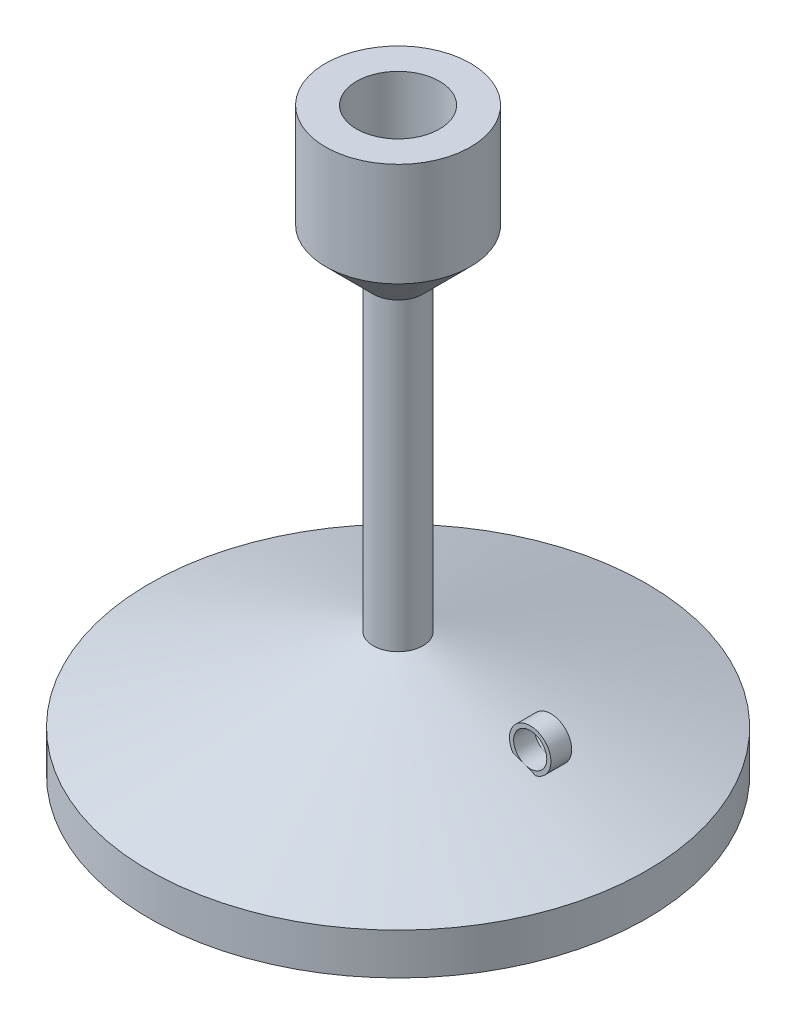
from build123d import *

# Parameters (mm, degrees)
SKETCH3_R           = 5
SKETCH3_R_2         = 4
BOSS_EXTRUDE1_DEPTH = 2.5


with BuildPart() as part:
    # Sketch2 → Revolve1 (revolve)
    with BuildSketch(Plane.XY, mode=Mode.PRIVATE) as revolve1_sk:
        Polygon((0, 120), (-10, 120), (-10, 140), (-17.5, 140), (-17.5, 115), (-6, 103.5), (-6, 30), (-60, 10), (-60, 0), (0, 0), align=None)
    revolve(revolve1_sk.sketch.rotate(Axis((0, 0, 0), (0, 1, 0)), 270), axis=Axis((0, 0, 0), (0, 1, 0)))

    # Sketch3 → Boss-Extrude1 (add, symmetric)
    with BuildSketch(Plane.XY):
        with Locations((34.389257423, 23.750995043)):
            Circle(SKETCH3_R)
        with Locations((34.389257423, 23.750995043)):
            Circle(SKETCH3_R_2, mode=Mode.SUBTRACT)
    extrude(amount=BOSS_EXTRUDE1_DEPTH, both=True)


solid = part.part
